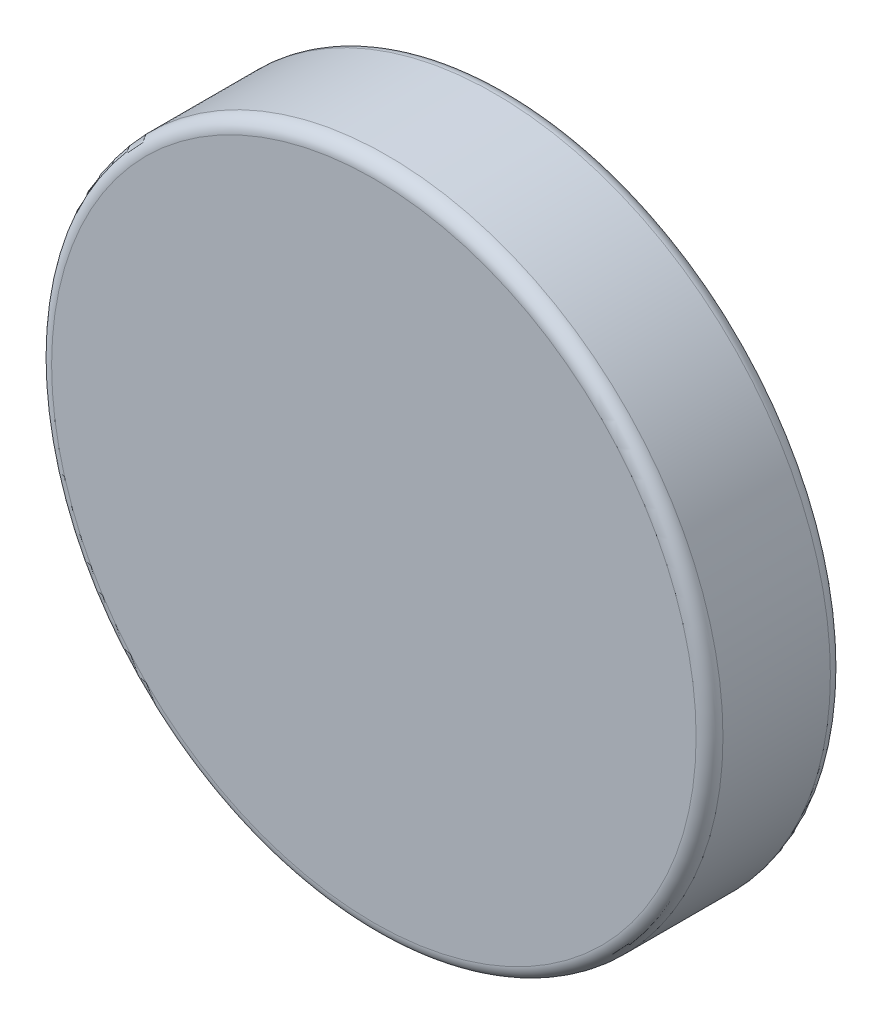
from build123d import *

# Parameters (mm, degrees)
SKETCH_1_R      = 5
EXTRUDE_1_DEPTH = 2
FILLET_1_R      = 0.2


with BuildPart() as part:
    # 草图1 → 凸台-拉伸1 (new body)
    with BuildSketch(Plane.XY):
        Circle(SKETCH_1_R)
    extrude(amount=EXTRUDE_1_DEPTH)

    # 圆角1
    fillet_1_edges = [part.edges().sort_by_distance(p)[0] for p in [
        (-5, 0, 0),
        (-5, 0, 2),
    ]]
    fillet(fillet_1_edges, radius=FILLET_1_R)


solid = part.part
